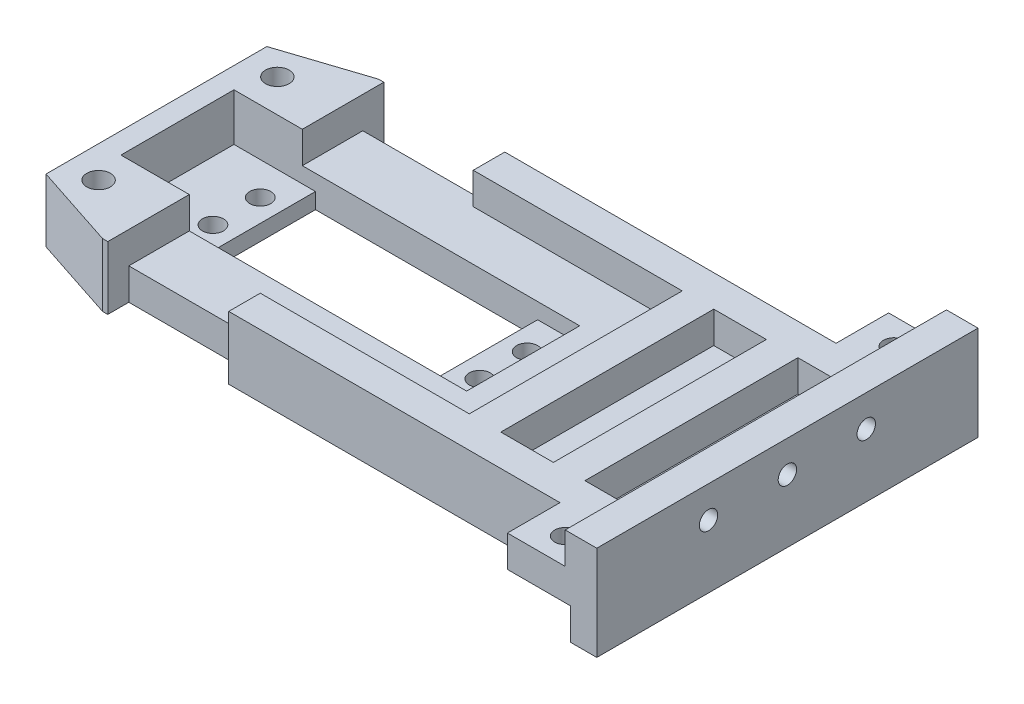
from build123d import *
from build123d.topology import SkipClean

# Parameters (mm, degrees)
SKETCH1_W           = 120
SKETCH1_H           = 52.5
BOSS_EXTRUDE1_DEPTH = 6
CUT_EXTRUDE1_DEPTH  = 6
SKETCH3_W           = 23
SKETCH3_H           = 4
CUT_EXTRUDE2_DEPTH  = 6
SKETCH4_W           = 42.25
SKETCH4_H           = 21.5
CUT_EXTRUDE3_DEPTH  = 6
SKETCH5_W           = 8
SKETCH5_H           = 21.5
SKETCH5_W_2         = 15.5
CUT_EXTRUDE4_DEPTH  = 3
SKETCH6_W           = 17
SKETCH6_H           = 72.5
BOSS_EXTRUDE2_DEPTH = 12
CUT_EXTRUDE6_DEPTH  = 136.831697332
SKETCH8_W           = 17
SKETCH8_H           = 36.25
CUT_EXTRUDE7_DEPTH  = 137.492673796
SKETCH9_W           = 65.75
SKETCH9_H           = 10.75
CUT_EXTRUDE8_DEPTH  = 6
SKETCH10_W          = 5
SKETCH10_H          = 6
BOSS_EXTRUDE3_DEPTH = 10
SKETCH14_R          = 2
CUT_EXTRUDE9_DEPTH  = 3
SKETCH15_R          = 2.25
CUT_EXTRUDE10_DEPTH = 136.831697332
SKETCH17_R          = 2
CUT_EXTRUDE11_DEPTH = 136.831697332
SKETCH18_W          = 11
SKETCH18_H          = 20.25
CUT_EXTRUDE12_DEPTH = 12
SKETCH19_R          = 1.75
CUT_EXTRUDE13_DEPTH = 132.248809518
SKETCH20_W          = 11
SKETCH20_H          = 16
CUT_EXTRUDE14_DEPTH = 6
SKETCH21_W          = 63
SKETCH21_H          = 6
BOSS_EXTRUDE6_DEPTH = 6
SKETCH22_W          = 6
SKETCH22_H          = 40.5
BOSS_EXTRUDE7_DEPTH = 6
BOSS_EXTRUDE8_START = 6
SKETCH24_R          = 2.25
BOSS_EXTRUDE8_DEPTH = 6


with BuildPart() as part:
    # Sketch1 → Boss-Extrude1 (new body)
    with BuildSketch(Plane(origin=(0, 0, 0), x_dir=(1, 0, 0), z_dir=(0, 1, 0))):
        with Locations((60, 26.25)):
            Rectangle(SKETCH1_W, SKETCH1_H)
    extrude(amount=BOSS_EXTRUDE1_DEPTH)

    # Sketch2 → Cut-Extrude1 (cut)
    with BuildSketch(Plane(origin=(0, 6, 0), x_dir=(1, 0, 0), z_dir=(0, 1, 0))):
        Polygon((0, 0), (16, 0), (0, 5.25), align=None)
        Polygon((0, 47.25), (0, 52.5), (16, 52.5), align=None)
    extrude(amount=-CUT_EXTRUDE1_DEPTH, mode=Mode.SUBTRACT)

    # Sketch3 → Cut-Extrude2 (cut)
    with BuildSketch(Plane(origin=(0, 6, 0), x_dir=(1, 0, 0), z_dir=(0, 1, 0))):
        with Locations((28.5, 2)):
            Rectangle(SKETCH3_W, SKETCH3_H)
        with Locations((28.5, 50.5)):
            Rectangle(SKETCH3_W, SKETCH3_H)
    extrude(amount=-CUT_EXTRUDE2_DEPTH, mode=Mode.SUBTRACT)

    # Sketch4 → Cut-Extrude3 (cut)
    with BuildSketch(Plane(origin=(0, 6, 0), x_dir=(1, 0, 0), z_dir=(0, 1, 0))):
        with Locations((40.625, 26.25)):
            Rectangle(SKETCH4_W, SKETCH4_H)
    extrude(amount=-CUT_EXTRUDE3_DEPTH, mode=Mode.SUBTRACT)

    # Sketch5 → Cut-Extrude4 (cut)
    with BuildSketch(Plane(origin=(0, 6, 0), x_dir=(1, 0, 0), z_dir=(0, 1, 0))):
        with Locations((65.75, 26.25)):
            Rectangle(SKETCH5_W, SKETCH5_H)
        with Locations((11.75, 26.25)):
            Rectangle(SKETCH5_W_2, SKETCH5_H)
    extrude(amount=-CUT_EXTRUDE4_DEPTH, mode=Mode.SUBTRACT)

    # Sketch6 → Boss-Extrude2 (add)
    with BuildSketch(Plane(origin=(0, 6, 0), x_dir=(1, 0, 0), z_dir=(0, 1, 0))):
        with Locations((111.5, 26.25)):
            Rectangle(SKETCH6_W, SKETCH6_H)
    extrude(amount=BOSS_EXTRUDE2_DEPTH)

    # Sketch7 → Cut-Extrude6 (cut, through all)
    with BuildSketch(Plane(origin=(0, 6, 0), x_dir=(1, 0, 0), z_dir=(0, 1, 0))):
        Polygon((103, 26.25), (69.75, 26.25), (69.75, 15.5), (4, 15.5), (4, 26.25), (0, 26.25), (0, 5.25), (16, 0), (17, 0), (17, 4), (40, 4), (40, 0), (103, 0), align=None)
    extrude(amount=-CUT_EXTRUDE6_DEPTH, mode=Mode.SUBTRACT)

    # Sketch8 → Cut-Extrude7 (cut, through all)
    with BuildSketch(Plane(origin=(0, 18, 0), x_dir=(1, 0, 0), z_dir=(0, 1, 0))):
        with Locations((111.5, 8.125)):
            Rectangle(SKETCH8_W, SKETCH8_H)
    extrude(amount=-CUT_EXTRUDE7_DEPTH, mode=Mode.SUBTRACT)

    # Sketch9 → Cut-Extrude8 (cut)
    with BuildSketch(Plane(origin=(0, 3, 0), x_dir=(1, 0, 0), z_dir=(0, 1, 0))):
        with Locations((36.875, 20.875)):
            Rectangle(SKETCH9_W, SKETCH9_H)
    extrude(amount=-CUT_EXTRUDE8_DEPTH, mode=Mode.SUBTRACT)

    # Sketch10 → Boss-Extrude3 (add)
    with BuildSketch(Plane(origin=(0, 0, -52.5), x_dir=(-1, 0, 0), z_dir=(0, 0, -1))):
        with Locations((-117.5, 3)):
            Rectangle(SKETCH10_W, SKETCH10_H)
    extrude(amount=BOSS_EXTRUDE3_DEPTH)

    # Sketch14 → Cut-Extrude9 (cut)
    with BuildSketch(Plane(origin=(0, 3, 0), x_dir=(1, 0, 0), z_dir=(0, 1, 0))):
        with Locations(Location((66, 30.75, 0), (0, 0, 270))):
            Circle(SKETCH14_R)
        with Locations(Location((15.25, 30.75, 0), (0, 0, 270))):
            Circle(SKETCH14_R)
    extrude(amount=-CUT_EXTRUDE9_DEPTH, mode=Mode.SUBTRACT)

    # Sketch15 → Cut-Extrude10 (cut, through all)
    with BuildSketch(Plane(origin=(0, 6, 0), x_dir=(1, 0, 0), z_dir=(0, 1, 0))):
        with Locations(Location((6, 43.25, 0), (0, 0, 270))):
            Circle(SKETCH15_R)
    extrude(amount=-CUT_EXTRUDE10_DEPTH, mode=Mode.SUBTRACT)

    # Sketch17 → Cut-Extrude11 (cut, through all)
    with BuildSketch(Plane.XZ.offset(-6)):
        with Locations(Location((109, -57.5, 0), (0, 0, 270))):
            Circle(SKETCH17_R)
    extrude(amount=-CUT_EXTRUDE11_DEPTH, mode=Mode.SUBTRACT)

    # Sketch18 → Cut-Extrude12 (cut)
    with BuildSketch(Plane(origin=(0, 18, 0), x_dir=(1, 0, 0), z_dir=(0, 1, 0))):
        with Locations((108.5, 36.375)):
            Rectangle(SKETCH18_W, SKETCH18_H)
    extrude(amount=-CUT_EXTRUDE12_DEPTH, mode=Mode.SUBTRACT)

    # Sketch19 → Cut-Extrude13 (cut, through all)
    with BuildSketch(Plane.ZY.offset(-114)):
        with Locations((-41.25, 12)):
            Circle(SKETCH19_R)
        with Locations((-26.25, 12)):
            Circle(SKETCH19_R)
    extrude(amount=-CUT_EXTRUDE13_DEPTH, mode=Mode.SUBTRACT)

    # Sketch20 → Cut-Extrude14 (cut)
    with BuildSketch(Plane(origin=(0, 18, 0), x_dir=(1, 0, 0), z_dir=(0, 1, 0))):
        with Locations((108.5, 54.5)):
            Rectangle(SKETCH20_W, SKETCH20_H)
    extrude(amount=-CUT_EXTRUDE14_DEPTH, mode=Mode.SUBTRACT)

    # Sketch21 → Boss-Extrude6 (add)
    with BuildSketch(Plane(origin=(0, 6, 0), x_dir=(1, 0, 0), z_dir=(0, 1, 0))):
        with Locations((71.5, 49.5)):
            Rectangle(SKETCH21_W, SKETCH21_H)
    extrude(amount=BOSS_EXTRUDE6_DEPTH)

    # Mirror1: part across plane


with BuildPart() as part_1:
    with SkipClean():  # the faces are left unmerged after this step: merging them gives an invalid solid
        add(part.part)
        add(part.part.mirror(Plane(origin=(103, -2.5e-05, -26.25), x_dir=(1, 0, 0), z_dir=(0, 0, -1))))

    # Sketch22 → Boss-Extrude7 (add)
    with SkipClean():  # the faces are left unmerged after this step: merging them gives an invalid solid
        with BuildSketch(Plane(origin=(0, 6, 0), x_dir=(1, 0, 0), z_dir=(0, 1, 0))):
            with Locations((82.75, 26.25)):
                Rectangle(SKETCH22_W, SKETCH22_H)
            with Locations((98.75, 26.25)):
                Rectangle(SKETCH22_W, SKETCH22_H)
        extrude(amount=BOSS_EXTRUDE7_DEPTH)

    # Sketch24 → Boss-Extrude8 (add)
    with BuildSketch(Plane(origin=(0, 6, 0), x_dir=(1, 0, 0), z_dir=(0, 1, 0)).offset(BOSS_EXTRUDE8_START)):
        Polygon((17, 15.5), (17, 0), (16, 0), (0, 5.25), (0, 47.25), (16, 52.5), (17, 52.5), (17, 37), (4, 37), (4, 15.5), align=None)
        with Locations(Location((6, 43.25, 0), (0, 0, 270))):
            Circle(SKETCH24_R, mode=Mode.SUBTRACT)
        with Locations(Location((6, 9.25, 0), (0, 0, 90))):
            Circle(SKETCH24_R, mode=Mode.SUBTRACT)
    extrude(amount=-BOSS_EXTRUDE8_DEPTH)


solid = part_1.part
